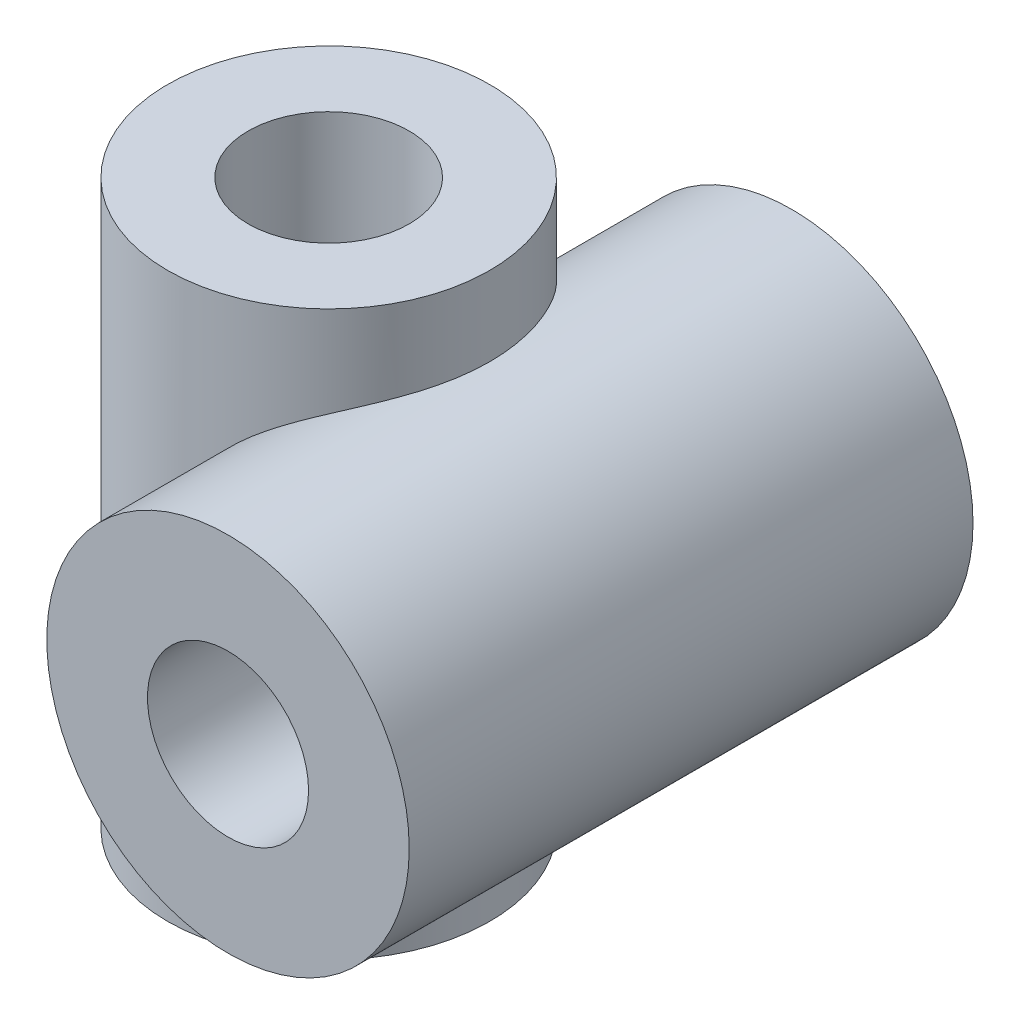
from build123d import *

# Parameters (mm, degrees)
SKETCH1_R                = 16
SKETCH1_R_2              = 8
BOSS_EXTRUDE1_DEPTH      = 56
BOSS_EXTRUDE2_DEPTH      = 28
BOSS_EXTRUDE2_DEPTH_BACK = 28
SKETCH2_R                = 18
SKETCH2_R_2              = 8
SKETCH3_R                = 8
CUT_EXTRUDE1_DEPTH       = 73.221880507
SKETCH4_R                = 8
CUT_EXTRUDE2_DEPTH       = 87.994252854
ESCALA1_SCALE            = 0.5


with BuildPart() as part:
    # Sketch1 → Boss-Extrude1 (new body)
    with BuildSketch(Plane(origin=(0, 0, 0), x_dir=(1, 0, 0), z_dir=(0, 1, 0))):
        Circle(SKETCH1_R)
        Circle(SKETCH1_R_2, mode=Mode.SUBTRACT)
    extrude(amount=BOSS_EXTRUDE1_DEPTH)

    # Sketch2 → Boss-Extrude2 (add, two sides: drawn at the far end of the back side and taken through both)
    with BuildSketch(Plane.XY.offset(-BOSS_EXTRUDE2_DEPTH_BACK)):
        with Locations((18, 30.258098715)):
            Circle(SKETCH2_R)
        with Locations((18, 30.258098715)):
            Circle(SKETCH2_R_2, mode=Mode.SUBTRACT)
    extrude(amount=BOSS_EXTRUDE2_DEPTH + BOSS_EXTRUDE2_DEPTH_BACK)

    # Sketch3 → Cut-Extrude1 (cut, through all)
    with BuildSketch(Plane(origin=(0, 56, 0), x_dir=(1, 0, 0), z_dir=(0, 1, 0))):
        Circle(SKETCH3_R)
    extrude(amount=-CUT_EXTRUDE1_DEPTH, mode=Mode.SUBTRACT)

    # Sketch4 → Cut-Extrude2 (cut, through all)
    with BuildSketch(Plane.XY.offset(28)):
        with Locations((18, 30.258098715)):
            Circle(SKETCH4_R)
    extrude(amount=-CUT_EXTRUDE2_DEPTH, mode=Mode.SUBTRACT)


with BuildPart() as part_1:
    # Escala1: scaled about (10.696798327, 29.156211429, -1.523e-06)
    add(part.part.scale(ESCALA1_SCALE).moved(Location((5.348399163, 14.578105714, -7.62e-07))))


solid = part_1.part
